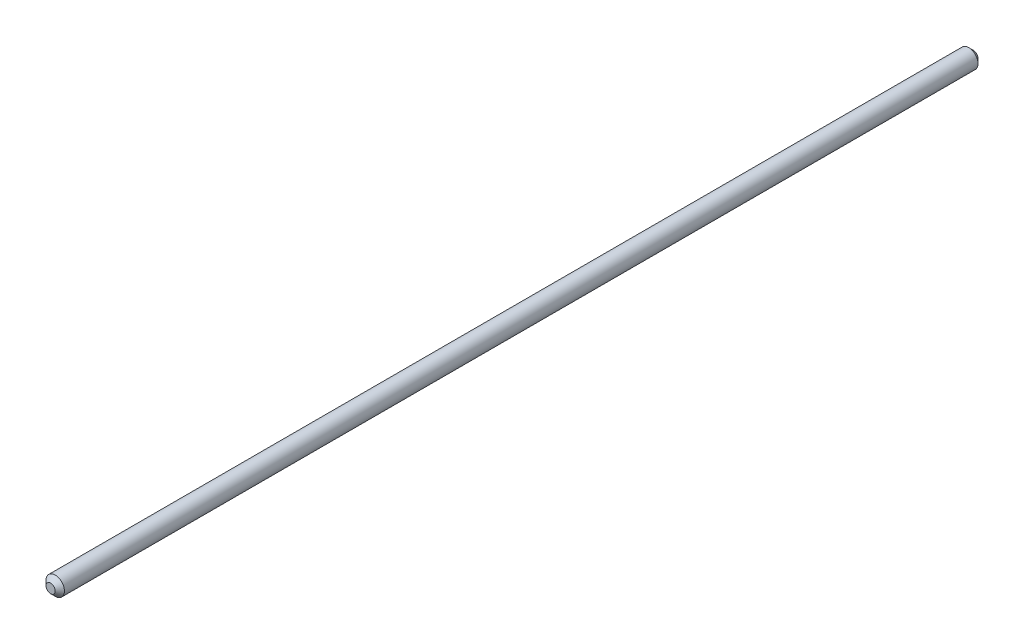
from build123d import *

# Parameters (mm, degrees)
CROQUIS1_R              = 4
SALIENTE_EXTRUIR1_DEPTH = 400
CHAFL_N1_SIZE           = 2


with BuildPart() as part:
    # Croquis1 → Saliente-Extruir1 (new body)
    with BuildSketch(Plane.XY):
        Circle(CROQUIS1_R)
    extrude(amount=SALIENTE_EXTRUIR1_DEPTH)

    # Chaflán1
    chafl_n1_edges = [part.edges().sort_by_distance(p)[0] for p in [
        (-4, 0, 0),
        (-4, 0, 400),
    ]]
    chamfer(chafl_n1_edges, length=CHAFL_N1_SIZE)


solid = part.part
